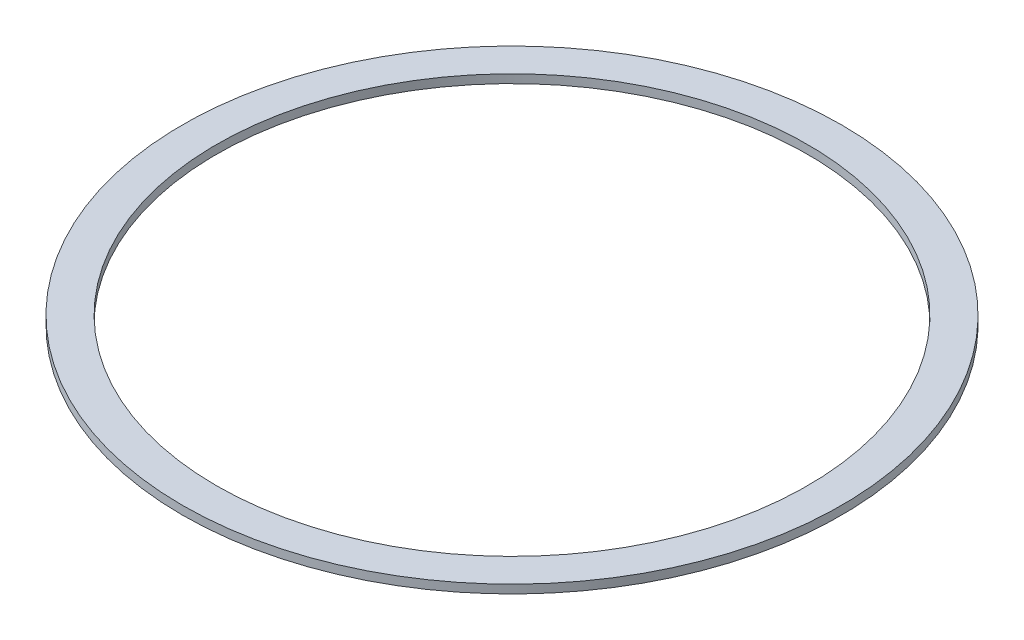
from build123d import *

# Parameters (mm, degrees)
SKETCH1_R           = 38.75
SKETCH1_R_2         = 34.75
BOSS_EXTRUDE1_DEPTH = 1


with BuildPart() as part:
    # Sketch1 → Boss-Extrude1 (new body)
    with BuildSketch(Plane(origin=(0, 0, 0), x_dir=(1, 0, 0), z_dir=(0, 1, 0))):
        with Locations(Location((0, 0, 0), (0, 0, 270))):
            Circle(SKETCH1_R)
        with Locations(Location((0, 0, 0), (0, 0, 270))):
            Circle(SKETCH1_R_2, mode=Mode.SUBTRACT)
    extrude(amount=BOSS_EXTRUDE1_DEPTH)


solid = part.part
